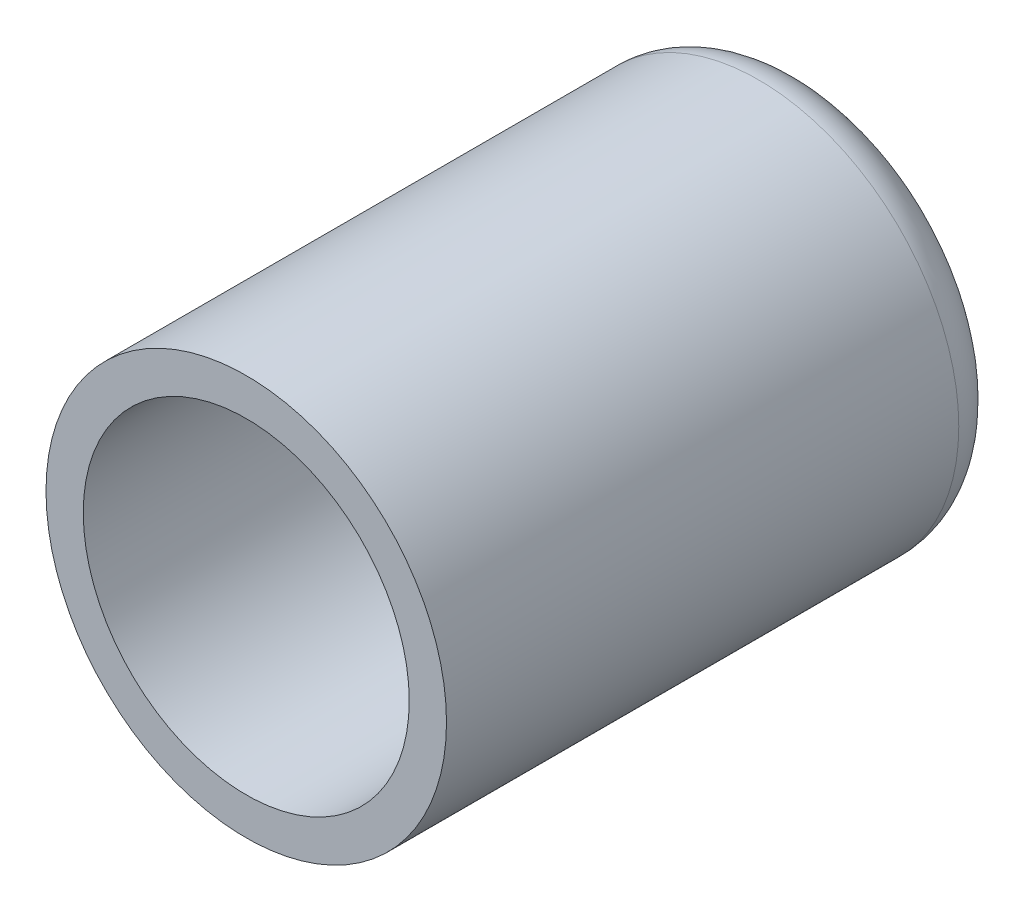
from build123d import *

# Parameters (mm, degrees)
SKETCH1_R           = 2.15
BOSS_EXTRUDE1_DEPTH = 6
SKETCH2_R           = 1.75
CUT_EXTRUDE1_DEPTH  = 5.5
FILLET1_R           = 0.5


with BuildPart() as part:
    # Sketch1 → Boss-Extrude1 (new body)
    with BuildSketch(Plane.XY):
        Circle(SKETCH1_R)
    extrude(amount=BOSS_EXTRUDE1_DEPTH)

    # Sketch2 → Cut-Extrude1 (cut)
    with BuildSketch(Plane.XY.offset(6)):
        Circle(SKETCH2_R)
    extrude(amount=-CUT_EXTRUDE1_DEPTH, mode=Mode.SUBTRACT)

    # Fillet1
    fillet1_edges = [part.edges().sort_by_distance(p)[0] for p in [
        (-2.15, 0, 0),
    ]]
    fillet(fillet1_edges, radius=FILLET1_R)


solid = part.part
